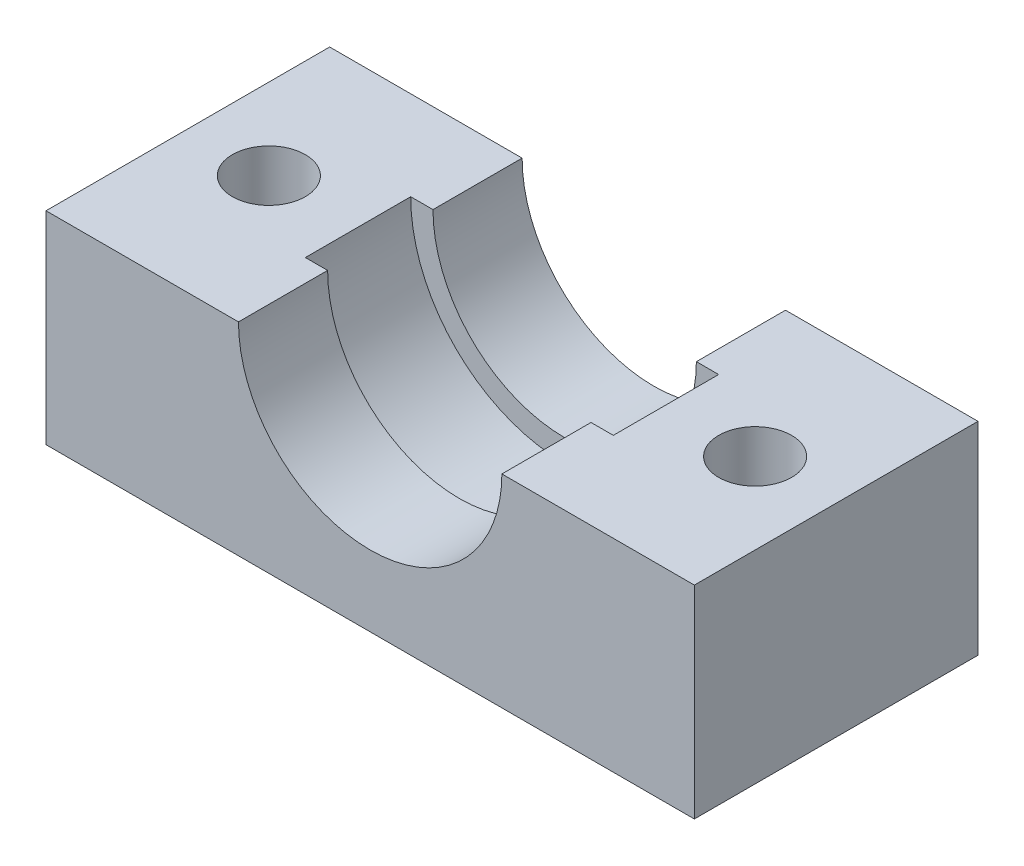
from build123d import *

# Parameters (mm, degrees)
SKETCH_1_W                   = 32
SKETCH_1_H                   = 14
EXTRUDE_1_DEPTH              = 10
SKETCH_2_R                   = 7.6
CUT_EXTRUDE_1_DEPTH          = 2.6
CUT_EXTRUDE_2_DEPTH          = 21.124611797
CUT_EXTRUDE_2_DEPTH_BACK     = 21.124611797
SKETCH_3_R                   = 6.5
SKETCH_4_R                   = 1
CUT_EXTRUDE_3_DEPTH          = 21.124611797
HOLE_WIZARD_M3_1_D           = 3.6
HOLE_WIZARD_M3_1_DEPTH       = 10
HOLE_WIZARD_M3_1_CBORE_D     = 6.5
HOLE_WIZARD_M3_1_CBORE_DEPTH = 3.4


with BuildPart() as part:
    # 草圖1 → 填料-伸長1 (new body)
    with BuildSketch(Plane(origin=(0, 0, 0), x_dir=(1, 0, 0), z_dir=(0, 1, 0))):
        Rectangle(SKETCH_1_W, SKETCH_1_H)
    extrude(amount=EXTRUDE_1_DEPTH)

    # 草圖2 → 除料-伸長1 (cut, symmetric)
    with BuildSketch(Plane.XY):
        with Locations((0, 10)):
            Circle(SKETCH_2_R)
    extrude(amount=CUT_EXTRUDE_1_DEPTH, both=True, mode=Mode.SUBTRACT)

    # 草圖3 → 除料-伸長2 (cut, two sides: drawn at the far end of the back side and taken through both)
    with BuildSketch(Plane.XY.offset(-CUT_EXTRUDE_2_DEPTH_BACK)):
        with Locations((0, 10)):
            Circle(SKETCH_3_R)
    extrude(amount=CUT_EXTRUDE_2_DEPTH + CUT_EXTRUDE_2_DEPTH_BACK, mode=Mode.SUBTRACT)

    # 草圖4 → 除料-伸長3 (cut, through all)
    with BuildSketch(Plane(origin=(0, 10, 0), x_dir=(1, 0, 0), z_dir=(0, 1, 0))):
        with Locations(Location((-12, 0, 0), (0, 0, 270))):
            Circle(SKETCH_4_R)
        with Locations(Location((12, 0, 0), (0, 0, 90))):
            Circle(SKETCH_4_R)
    extrude(amount=-CUT_EXTRUDE_3_DEPTH, mode=Mode.SUBTRACT)

    # M3 六角承窩頭蓋螺釘的柱孔1
    with Locations(Plane(origin=(0, 0, 0), x_dir=(-1, 0, 0), z_dir=(0, -1, 0))):
        with Locations((-12, 0), (12, 0)):
            CounterBoreHole(HOLE_WIZARD_M3_1_D / 2, HOLE_WIZARD_M3_1_CBORE_D / 2, HOLE_WIZARD_M3_1_CBORE_DEPTH, depth=HOLE_WIZARD_M3_1_DEPTH)


solid = part.part
